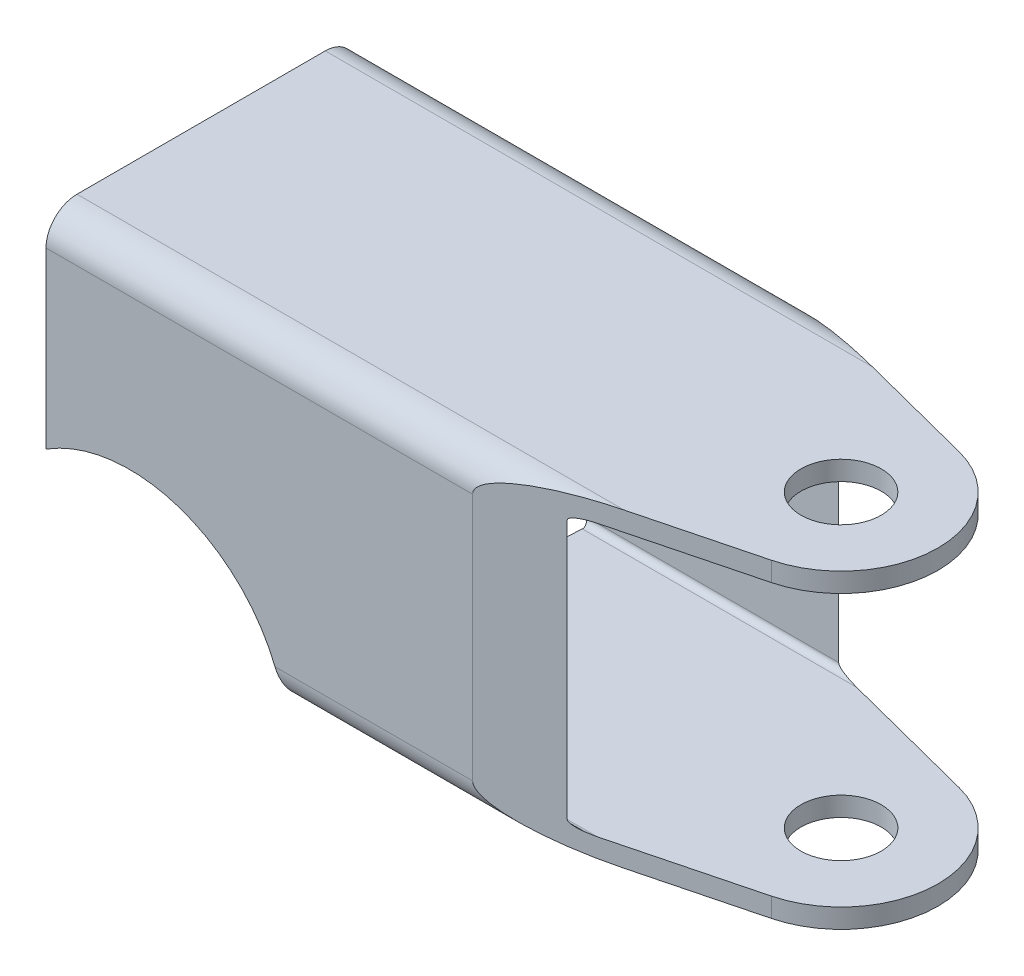
from build123d import *

# Parameters (mm, degrees)
BOSS_EXTRUDE1_DEPTH      = 25.4
BOSS_EXTRUDE1_DEPTH_BACK = 34.925
CUT_EXTRUDE4_DEPTH       = 63.941922635
CUT_EXTRUDE5_DEPTH       = 46.01339384
SKETCH14_R               = 3.2893
CUT_EXTRUDE6_DEPTH       = 46.01339384
CUT_EXTRUDE7_DEPTH       = 12.7
CUT_EXTRUDE7_DEPTH_BACK  = 38.1
SKETCH15_R               = 12.7


with BuildPart() as part:
    # Sketch1 → Boss-Extrude1 (new, two sides: drawn at the far end of the back side and taken through both)
    with BuildSketch(Plane(origin=(0, 0, 0), x_dir=(0, 0, -1), z_dir=(1, 0, 0)).offset(-BOSS_EXTRUDE1_DEPTH_BACK)):
        with BuildLine():
            Line((-10.16, 12.7), (10.16, 12.7))
            ThreePointArc((10.16, 12.7), (11.956051224, 11.956051224), (12.7, 10.16))
            Line((12.7, 10.16), (12.7, -10.16))
            ThreePointArc((12.7, -10.16), (11.956051224, -11.956051224), (10.16, -12.7))
            Line((10.16, -12.7), (-10.16, -12.7))
            ThreePointArc((-10.16, -12.7), (-11.956051224, -11.956051224), (-12.7, -10.16))
            Line((-12.7, -10.16), (-12.7, 10.16))
            ThreePointArc((-12.7, 10.16), (-11.956051224, 11.956051224), (-10.16, 12.7))
        make_face()
    extrude(amount=BOSS_EXTRUDE1_DEPTH + BOSS_EXTRUDE1_DEPTH_BACK)

    # Sketch11 → Cut-Extrude4 (cut, through all)
    with BuildSketch(Plane(origin=(25.4, 0, 0), x_dir=(0, 0, -1), z_dir=(1, 0, 0))):
        with BuildLine():
            Line((-10.6045, 11.1125), (10.6045, 11.1125))
            ThreePointArc((10.6045, 11.1125), (10.963710245, 10.963710245), (11.1125, 10.6045))
            Line((11.1125, 10.6045), (11.1125, -10.6045))
            ThreePointArc((11.1125, -10.6045), (10.963710245, -10.963710245), (10.6045, -11.1125))
            Line((10.6045, -11.1125), (-10.6045, -11.1125))
            ThreePointArc((-10.6045, -11.1125), (-10.963710245, -10.963710245), (-11.1125, -10.6045))
            Line((-11.1125, -10.6045), (-11.1125, 10.6045))
            ThreePointArc((-11.1125, 10.6045), (-10.963710245, 10.963710245), (-10.6045, 11.1125))
        make_face()
    extrude(amount=-CUT_EXTRUDE4_DEPTH, mode=Mode.SUBTRACT)

    # Sketch12 → Cut-Extrude5 (cut, through all)
    with BuildSketch(Plane(origin=(0, 12.7, 0), x_dir=(1, 0, 0), z_dir=(0, 1, 0))):
        with BuildLine():
            Line((50.8, 12.7), (0, 12.7))
            Line((0, 12.7), (19.444424463, 7.686083637))
            ThreePointArc((19.444424463, 7.686083637), (25.4, 0), (19.444424463, -7.686083637))
            Line((19.444424463, -7.686083637), (0, -12.7))
            Line((0, -12.7), (50.8, -12.7))
            Line((50.8, -12.7), (50.8, 12.7))
        make_face()
    extrude(amount=-CUT_EXTRUDE5_DEPTH, mode=Mode.SUBTRACT)

    # Sketch14 → Cut-Extrude6 (cut, through all)
    with BuildSketch(Plane(origin=(0, 12.7, 0), x_dir=(1, 0, 0), z_dir=(0, 1, 0))):
        with Locations((17.4625, 0)):
            Circle(SKETCH14_R)
    extrude(amount=-CUT_EXTRUDE6_DEPTH, mode=Mode.SUBTRACT)

    # Sketch15 → Cut-Extrude7 (cut, two sides: drawn at the far end of the back side and taken through both)
    with BuildSketch(Plane(origin=(-28.000601556, -14.856223036, 12.7), x_dir=(0.9956294808615993, 0.00690045849591187, 0.09313603229582208), z_dir=(-0.09339131029845452, 0.0735646591533628, 0.9929080038374085)).offset(-CUT_EXTRUDE7_DEPTH_BACK)):
        Circle(SKETCH15_R)
    extrude(amount=CUT_EXTRUDE7_DEPTH + CUT_EXTRUDE7_DEPTH_BACK, mode=Mode.SUBTRACT)


solid = part.part
